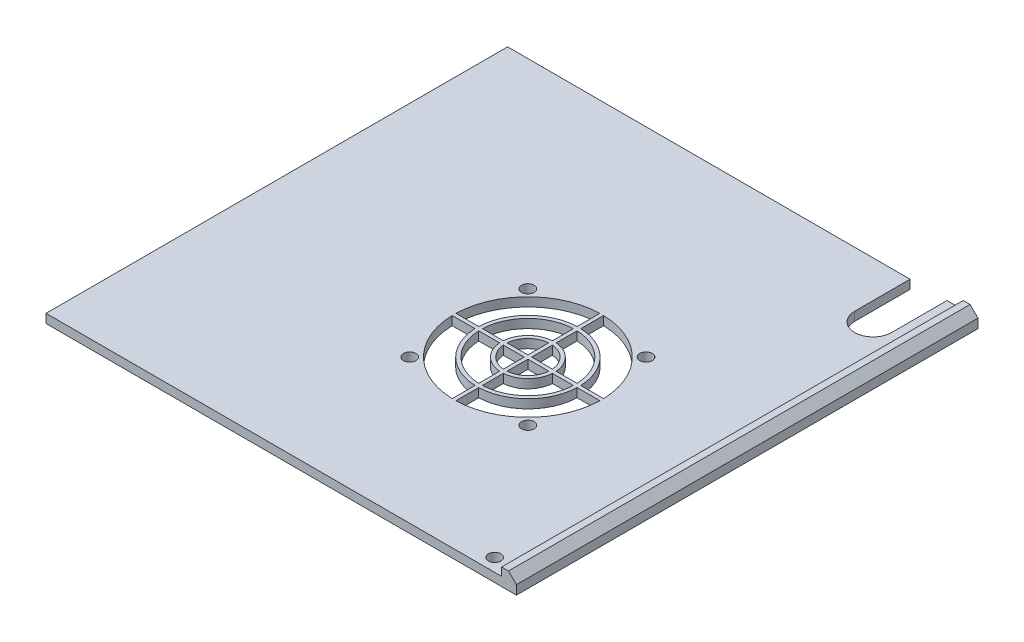
from build123d import *

# Parameters (mm, degrees)
SKETCH1_W           = 121.5
SKETCH1_H           = 125
BOSS_EXTRUDE1_DEPTH = 2.4
BOSS_EXTRUDE2_DEPTH = 125
SKETCH4_R           = 1.7
CUT_EXTRUDE1_DEPTH  = 92.401490688
CUT_EXTRUDE2_DEPTH  = 92.401490688
SKETCH6_R           = 1.7
CUT_EXTRUDE3_DEPTH  = 92.401490688
CUT_EXTRUDE4_DEPTH  = 92.401490688
CIRPATTERN1_COUNT   = 4


with BuildPart() as part:
    # Sketch1 → Boss-Extrude1 (new body)
    with BuildSketch(Plane(origin=(0, 0, 0), x_dir=(1, 0, 0), z_dir=(0, 1, 0))):
        Rectangle(SKETCH1_W, SKETCH1_H)
    extrude(amount=BOSS_EXTRUDE1_DEPTH)

    # Sketch3 → Boss-Extrude2 (add)
    with BuildSketch(Plane.XY.offset(62.5)):
        Polygon((60.75, 0), (60.75, 2.4), (62.55, 2.4), (62.65, 2.4), (62.65, 4.61), (64.508602565, 4.61), (66.65, 2.470350907), (66.65, 0), align=None)
    extrude(amount=-BOSS_EXTRUDE2_DEPTH)

    # Sketch4 → Cut-Extrude1 (cut, through all)
    with BuildSketch(Plane(origin=(0, 2.4, 0), x_dir=(1, 0, 0), z_dir=(0, 1, 0))):
        with Locations(Location((57.25, -59, 0), (0, 0, 270))):
            Circle(SKETCH4_R)
    extrude(amount=-CUT_EXTRUDE1_DEPTH, mode=Mode.SUBTRACT)

    # Sketch5 → Cut-Extrude2 (cut, through all)
    with BuildSketch(Plane(origin=(0, 2.4, 0), x_dir=(1, 0, 0), z_dir=(0, 1, 0))):
        with BuildLine():
            Line((58.25, 47.5), (58.25, 62.5))
            Line((58.25, 62.5), (48.25, 62.5))
            Line((48.25, 62.5), (48.25, 47.5))
            ThreePointArc((48.25, 47.5), (53.25, 42.5), (58.25, 47.5))
        make_face()
    extrude(amount=-CUT_EXTRUDE2_DEPTH, mode=Mode.SUBTRACT)

    # Sketch6 → Cut-Extrude3 (cut, through all)
    with BuildSketch(Plane(origin=(0, 2.4, 0), x_dir=(1, 0, 0), z_dir=(0, 1, 0))):
        with Locations(Location((-1.25, -23.5, 0), (0, 0, 270))):
            Circle(SKETCH6_R)
        with Locations(Location((30.75, -23.5, 0), (0, 0, 270))):
            Circle(SKETCH6_R)
        with Locations(Location((30.75, 8.5, 0), (0, 0, 270))):
            Circle(SKETCH6_R)
        with Locations(Location((-1.25, 8.5, 0), (0, 0, 270))):
            Circle(SKETCH6_R)
    extrude(amount=-CUT_EXTRUDE3_DEPTH, mode=Mode.SUBTRACT)

    # Sketch7 → Cut-Extrude4 (cut, through all)
    with BuildSketch(Plane(origin=(0, 2.4, 0), x_dir=(1, 0, 0), z_dir=(0, 1, 0))):
        with BuildLine():
            Line((15.256250977, -7), (20.900523404, -7))
            ThreePointArc((20.900523404, -7), (19.115269425, -3.140981552), (15.256250977, -1.355727573))
            Line((15.256250977, -1.355727573), (15.256250977, -7))
        make_face()
        with BuildLine():
            Line((21.903365757, -7), (27.575669866, -7))
            ThreePointArc((27.575669866, -7), (23.827841263, 1.571590286), (15.256250977, 5.319418889))
            Line((15.256250977, 5.319418889), (15.256250977, -0.35288522))
            ThreePointArc((15.256250977, -0.35288522), (19.822376206, -2.433874771), (21.903365757, -7))
        make_face()
        with BuildLine():
            ThreePointArc((15.256250977, 6.320124192), (24.534948045, 2.278697068), (28.576375169, -7))
            Line((28.576375169, -7), (34.75, -7))
            ThreePointArc((34.75, -7), (28.898386601, 6.642135624), (15.256250977, 12.493749023))
            Line((15.256250977, 12.493749023), (15.256250977, 6.320124192))
        make_face()
    cut_extrude4 = extrude(amount=-CUT_EXTRUDE4_DEPTH, mode=Mode.SUBTRACT)

    # CirPattern1: Cut-Extrude4 ×4 about axis
    cirpattern1_axis = Axis((14.756250977, 0, 7.5), (0, 1, 0))
    for i in range(1, CIRPATTERN1_COUNT):
        add(cut_extrude4.rotate(cirpattern1_axis, i * 360 / CIRPATTERN1_COUNT), mode=Mode.SUBTRACT)


solid = part.part
